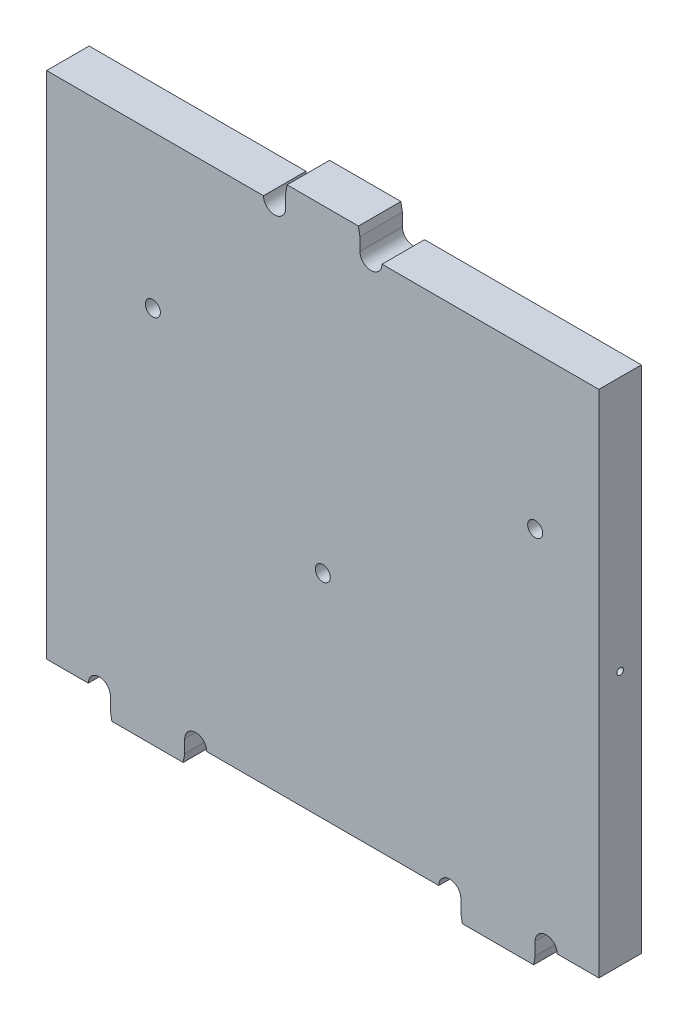
from build123d import *

# Parameters (mm, degrees)
SKETCH1_W             = 165.1
SKETCH1_H             = 152.4
BOSS_EXTRUDE1_DEPTH   = 12.7
BOSS_EXTRUDE2_DEPTH   = 12.7
CUT_EXTRUDE1_REACH    = 119.432
BOSS_EXTRUDE3_DEPTH   = 12.7
CUT_EXTRUDE2_DEPTH    = 12.7
F_8_CLEARANCE_HOLE1_D = 4.4958
SKETCH20_R            = 0.99187
CUT_EXTRUDE9_DEPTH    = 25.4
SKETCH21_R            = 3.175
SKETCH21_R_2          = 4.7625
CUT_EXTRUDE10_DEPTH   = 6.35


with BuildPart() as part:
    # Sketch1 → Boss-Extrude1 (new body)
    with BuildSketch(Plane.XY):
        Rectangle(SKETCH1_W, SKETCH1_H)
    extrude(amount=BOSS_EXTRUDE1_DEPTH)

    # Sketch2 → Boss-Extrude2 (add)
    with BuildSketch(Plane.XY.offset(12.7)):
        Polygon((-11.1125, 76.2), (11.1125, 76.2), (11.1125, 80.01), (10.664629469, 82.55), (-10.664629469, 82.55), (-11.1125, 80.01), align=None)
    extrude(amount=-BOSS_EXTRUDE2_DEPTH)

    # Sketch4 → Cut-Extrude1 (cut, up to next)
    with BuildSketch(Plane.XY.offset(12.7), mode=Mode.PRIVATE) as cut_extrude1_sk1:
        with BuildLine():
            Line((-17.7165, 76.2), (-11.1125, 76.2))
            ThreePointArc((-11.1125, 76.2), (-14.4145, 72.898), (-17.7165, 76.2))
        make_face()
    cut_extrude1_tool1 = extrude(cut_extrude1_sk1.sketch, amount=-CUT_EXTRUDE1_REACH, mode=Mode.PRIVATE) & part.part
    # Sketch4 → Cut-Extrude1 (cut, up to next)
    with BuildSketch(Plane.XY.offset(12.7), mode=Mode.PRIVATE) as cut_extrude1_sk2:
        with BuildLine():
            Line((11.1125, 76.2), (17.7165, 76.2))
            ThreePointArc((17.7165, 76.2), (14.4145, 72.898), (11.1125, 76.2))
        make_face()
    cut_extrude1_tool2 = extrude(cut_extrude1_sk2.sketch, amount=-CUT_EXTRUDE1_REACH, mode=Mode.PRIVATE) & part.part
    add(cut_extrude1_tool1.solids().sort_by_distance((-14.4145, 74.798588, 12.7))[0], mode=Mode.SUBTRACT)
    add(cut_extrude1_tool2.solids().sort_by_distance((14.4145, 74.798588, 12.7))[0], mode=Mode.SUBTRACT)

    # Sketch5 → Boss-Extrude3 (add)
    with BuildSketch(Plane.XY.offset(12.7)):
        Polygon((63.5, -76.2), (41.275, -76.2), (41.275, -80.01), (41.722870531, -82.55), (63.052129469, -82.55), (63.5, -80.01), align=None)
    boss_extrude3 = extrude(amount=-BOSS_EXTRUDE3_DEPTH)

    # Sketch6 → Cut-Extrude2 (cut)
    with BuildSketch(Plane.XY.offset(12.7)):
        with BuildLine():
            Line((34.671, -76.2), (41.275, -76.2))
            ThreePointArc((41.275, -76.2), (37.973, -72.898), (34.671, -76.2))
        make_face()
        with BuildLine():
            Line((63.5, -76.2), (70.104, -76.2))
            ThreePointArc((70.104, -76.2), (66.802, -72.898), (63.5, -76.2))
        make_face()
    cut_extrude2 = extrude(amount=-CUT_EXTRUDE2_DEPTH, mode=Mode.SUBTRACT)

    # Mirror1: Boss-Extrude3, Cut-Extrude2 across plane
    add(boss_extrude3.mirror(Plane(origin=(0, 0, 0), x_dir=(0, 0, 1), z_dir=(1, 0, 0))))
    add(cut_extrude2.mirror(Plane(origin=(0, 0, 0), x_dir=(0, 0, 1), z_dir=(1, 0, 0))), mode=Mode.SUBTRACT)

    # #8 Clearance Hole1 (through all)
    with Locations(Plane.XY.offset(12.7)):
        with Locations((0, -12.655936751), (63.5, 30.528732114), (-50.8, 30.528732114)):
            Hole(F_8_CLEARANCE_HOLE1_D / 2)

    # Sketch20 → Cut-Extrude9 (cut)
    with BuildSketch(Plane(origin=(82.55, 0, 0), x_dir=(0, 0, -1), z_dir=(1, 0, 0))):
        with Locations((-6.35, 0)):
            Circle(SKETCH20_R)
    cut_extrude9 = extrude(amount=-CUT_EXTRUDE9_DEPTH, mode=Mode.SUBTRACT)

    # Mirror3: Cut-Extrude9 across plane
    add(cut_extrude9.mirror(Plane(origin=(0, 0, 0), x_dir=(0, 0, 1), z_dir=(1, 0, 0))), mode=Mode.SUBTRACT)

    # Sketch21 → Cut-Extrude10 (cut)
    with BuildSketch(Plane(origin=(0, 0, 0), x_dir=(-1, 0, 0), z_dir=(0, 0, -1))):
        with Locations((0, -12.655936751)):
            Circle(SKETCH21_R)
        with Locations((-63.5, 30.528732114)):
            Circle(SKETCH21_R_2)
        with Locations((50.8, 30.528732114)):
            Circle(SKETCH21_R_2)
    extrude(amount=-CUT_EXTRUDE10_DEPTH, mode=Mode.SUBTRACT)


solid = part.part
